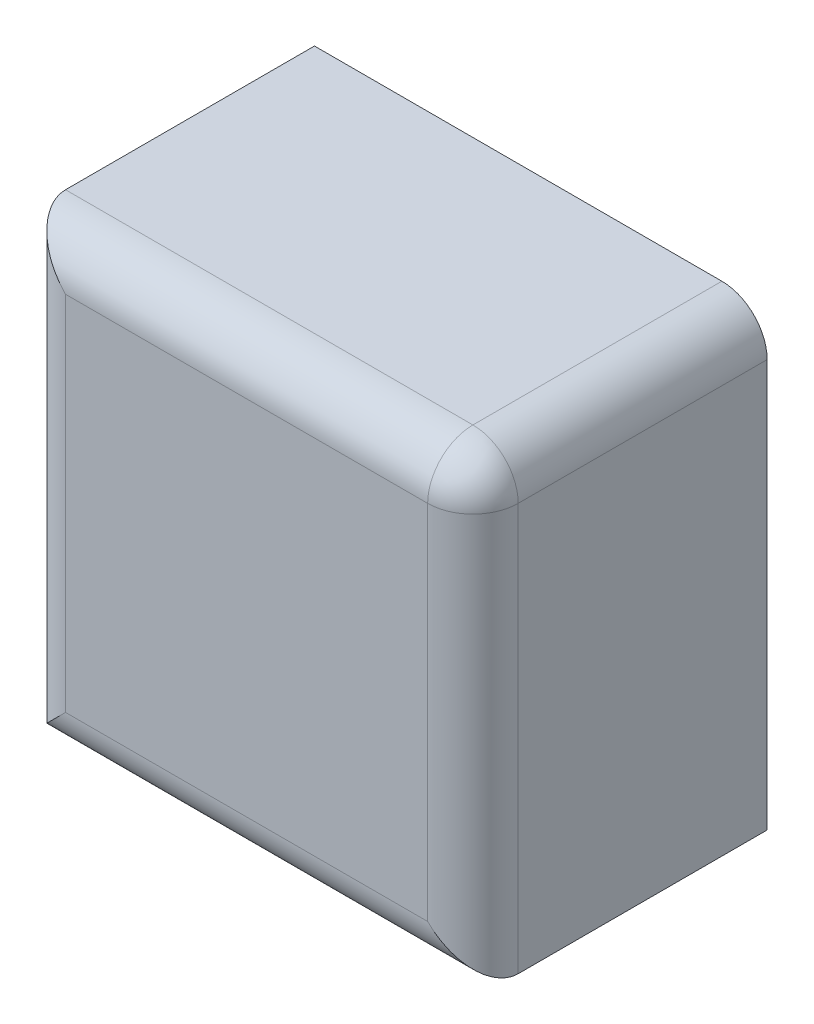
from build123d import *

# Parameters (mm, degrees)
SKETCH1_W                = 10
SKETCH1_H                = 10
BOSS_EXTRUDE1_DEPTH      = 6.5
FILLET1_R                = 1
M2_CLEARANCE_HOLE1_D     = 2.4
M2_CLEARANCE_HOLE1_DEPTH = 4
M2_CLEARANCE_HOLE1_TIP   = 0.721032743


with BuildPart() as part:
    # Sketch1 → Boss-Extrude1 (new body)
    with BuildSketch(Plane.XY):
        with Locations((5, 5)):
            Rectangle(SKETCH1_W, SKETCH1_H)
    extrude(amount=BOSS_EXTRUDE1_DEPTH)

    # Fillet1
    fillet1_edges = [part.edges().sort_by_distance(p)[0] for p in [
        (10, 5, 6.5),
        (5, 10, 6.5),
        (0, 5, 6.5),
        (5, 0, 6.5),
        (10, 10, 3.25),
    ]]
    fillet(fillet1_edges, radius=FILLET1_R)

    # M2 Clearance Hole1
    with Locations(Plane(origin=(0, 0, 0), x_dir=(-1, 0, 0), z_dir=(0, 0, -1))):
        with Locations((-3.5, 3.5)):
            Hole(M2_CLEARANCE_HOLE1_D / 2, depth=M2_CLEARANCE_HOLE1_DEPTH)
            with Locations((0, 0, -(M2_CLEARANCE_HOLE1_DEPTH + M2_CLEARANCE_HOLE1_TIP / 2))):  # 118° drill point
                Cone(0, M2_CLEARANCE_HOLE1_D / 2, M2_CLEARANCE_HOLE1_TIP, mode=Mode.SUBTRACT)


solid = part.part
